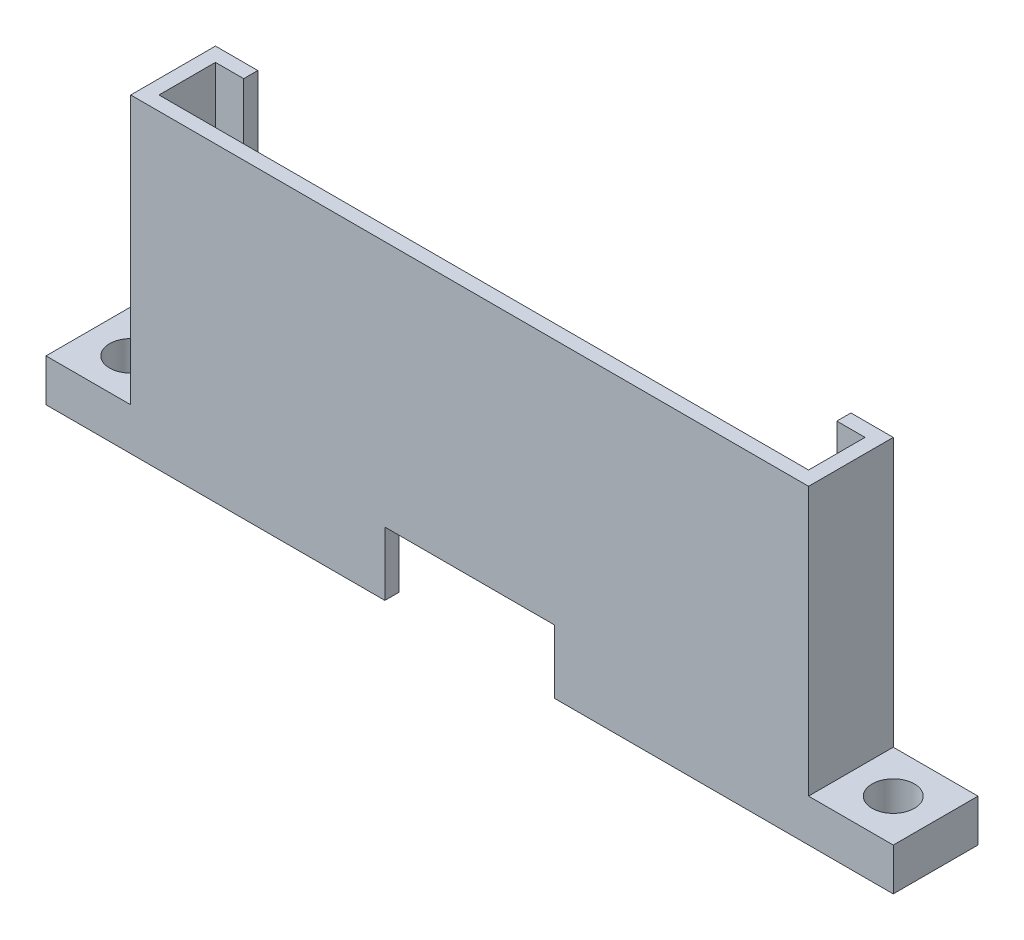
from build123d import *

# Parameters (mm, degrees)
SKETCH_1_W          = 48
SKETCH_1_H          = 22
EXTRUDE_1_DEPTH     = 6
SKETCH_4_W          = 46
SKETCH_4_H          = 4
CUT_EXTRUDE_2_DEPTH = 22
SKETCH_5_W          = 42
SKETCH_5_H          = 1
CUT_EXTRUDE_3_DEPTH = 22
SKETCH_9_W          = 12
SKETCH_9_H          = 4.5
CUT_EXTRUDE_5_DEPTH = 6
SKETCH_10_W         = 6
SKETCH_10_H         = 3
EXTRUDE_2_DEPTH     = 6
SKETCH_11_W         = 6
SKETCH_11_H         = 3
EXTRUDE_3_DEPTH     = 6
SKETCH_12_R         = 1.5
CUT_EXTRUDE_6_DEPTH = 3
SKETCH_14_R         = 1.5
CUT_EXTRUDE_7_DEPTH = 3


with BuildPart() as part:
    # 草圖1 → 填料-伸長1 (new body)
    with BuildSketch(Plane.XY):
        with Locations((-24, -11)):
            Rectangle(SKETCH_1_W, SKETCH_1_H)
    extrude(amount=EXTRUDE_1_DEPTH)

    # 草圖4 → 除料-伸長2 (cut)
    with BuildSketch(Plane(origin=(0, 0, 0), x_dir=(1, 0, 0), z_dir=(0, 1, 0))):
        with Locations((-24, -3)):
            Rectangle(SKETCH_4_W, SKETCH_4_H)
    extrude(amount=-CUT_EXTRUDE_2_DEPTH, mode=Mode.SUBTRACT)

    # 草圖5 → 除料-伸長3 (cut)
    with BuildSketch(Plane(origin=(0, 0, 0), x_dir=(1, 0, 0), z_dir=(0, 1, 0))):
        with Locations((-24, -0.5)):
            Rectangle(SKETCH_5_W, SKETCH_5_H)
    extrude(amount=-CUT_EXTRUDE_3_DEPTH, mode=Mode.SUBTRACT)

    # 草圖9 → 除料-伸長5 (cut)
    with BuildSketch(Plane.XY.offset(6)):
        with Locations((-24, -19.75)):
            Rectangle(SKETCH_9_W, SKETCH_9_H)
    extrude(amount=-CUT_EXTRUDE_5_DEPTH, mode=Mode.SUBTRACT)

    # 草圖10 → 填料-伸長2 (add)
    with BuildSketch(Plane(origin=(0, 0, 0), x_dir=(0, 0, -1), z_dir=(1, 0, 0))):
        with Locations((-3, -20.5)):
            Rectangle(SKETCH_10_W, SKETCH_10_H)
    extrude(amount=EXTRUDE_2_DEPTH)

    # 草圖11 → 填料-伸長3 (add)
    with BuildSketch(Plane.ZY.offset(48)):
        with Locations((3, -20.5)):
            Rectangle(SKETCH_11_W, SKETCH_11_H)
    extrude(amount=EXTRUDE_3_DEPTH)

    # 草圖12 → 除料-伸長6 (cut)
    with BuildSketch(Plane(origin=(0, -19, 0), x_dir=(1, 0, 0), z_dir=(0, 1, 0))):
        with Locations(Location((3, -3, 0), (0, 0, 180))):
            Circle(SKETCH_12_R)
    extrude(amount=-CUT_EXTRUDE_6_DEPTH, mode=Mode.SUBTRACT)

    # 草圖14 → 除料-伸長7 (cut)
    with BuildSketch(Plane(origin=(0, -19, 0), x_dir=(1, 0, 0), z_dir=(0, 1, 0))):
        with Locations(Location((-51, -3, 0), (0, 0, 270))):
            Circle(SKETCH_14_R)
    extrude(amount=-CUT_EXTRUDE_7_DEPTH, mode=Mode.SUBTRACT)


solid = part.part
